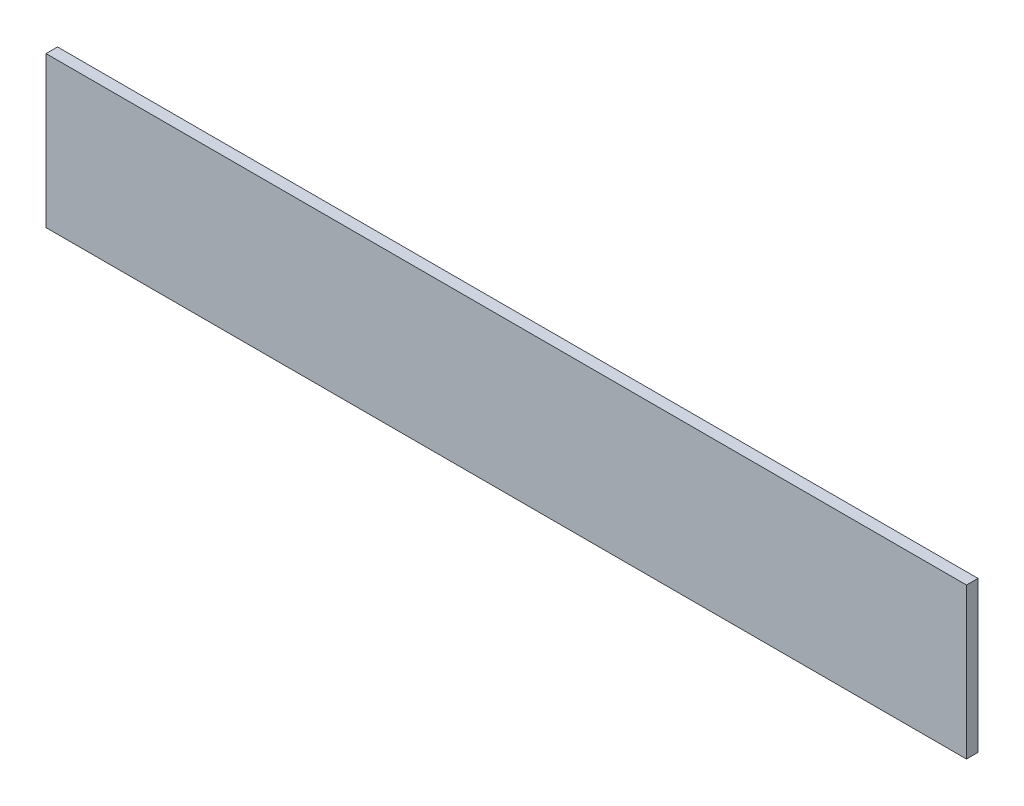
from build123d import *

# Parameters (mm, degrees)
SKETCH1_W           = 80
SKETCH1_H           = 13.1
BOSS_EXTRUDE1_DEPTH = 1


with BuildPart() as part:
    # Sketch1 → Boss-Extrude1 (new body)
    with BuildSketch(Plane.XY):
        Rectangle(SKETCH1_W, SKETCH1_H)
    extrude(amount=BOSS_EXTRUDE1_DEPTH)


solid = part.part
